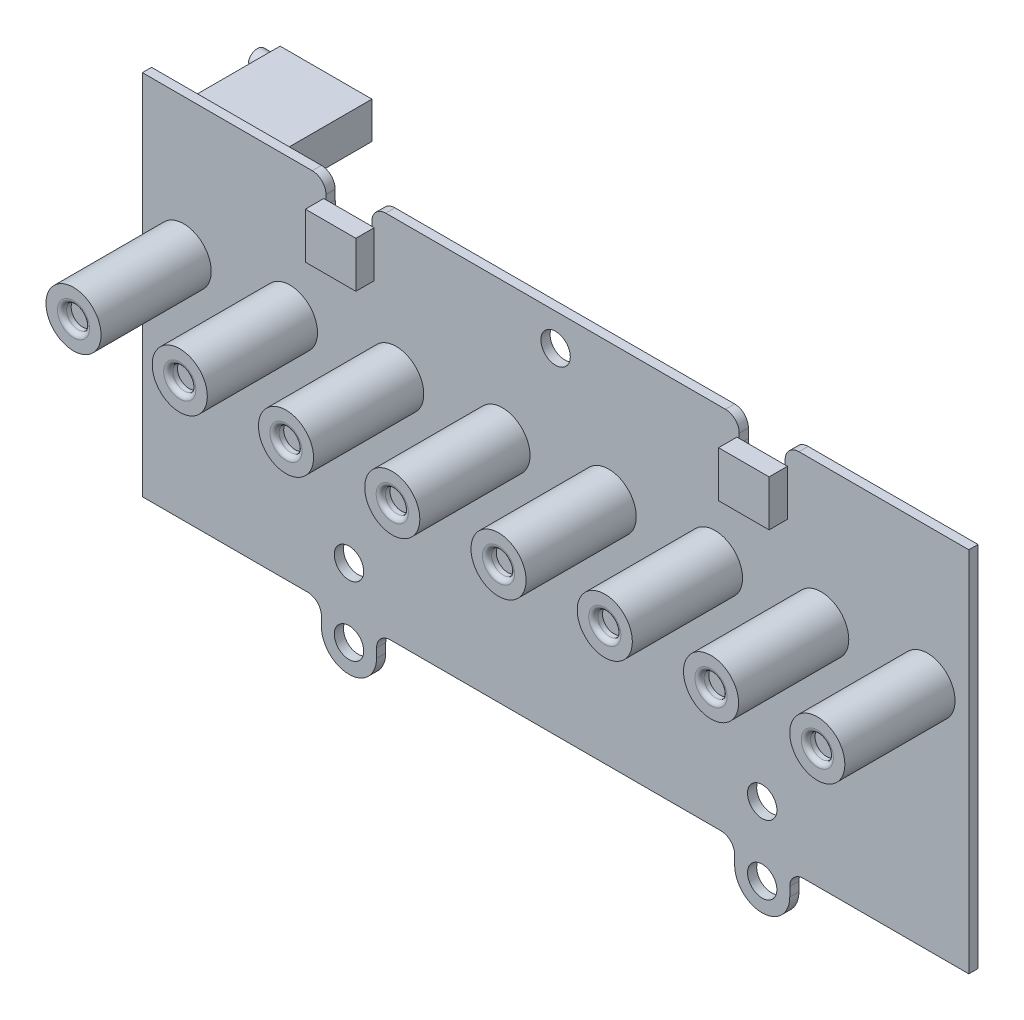
from build123d import *

# Parameters (mm, degrees)
SKETCH_1_R          = 1.6
EXTRUDE_1_DEPTH     = 1
FILLET_2_R          = 1.5
SKETCH_2_W          = 5.5
SKETCH_2_H          = 5
EXTRUDE_7_DEPTH     = 2
SKETCH_3_R          = 3
EXTRUDE_8_DEPTH     = 12
SKETCH_4_R          = 1.25
CUT_EXTRUDE_1_DEPTH = 1
FILLET_3_R          = 0.5
SKETCH_5_W          = 10
SKETCH_5_H          = 4
EXTRUDE_9_DEPTH     = 10
SKETCH_6_R          = 1
EXTRUDE_10_DEPTH    = 1.2
CUT_EXTRUDE_START   = -0.1
CUT_EXTRUDE_2_DEPTH = 0.1
SKETCH_8_W          = 10
SKETCH_8_H          = 4
SKETCH_8_W_2        = 6
EXTRUDE_11_DEPTH    = 2
EXTRUDE_12_DEPTH    = 3
SKETCH_11_R         = 0.25
EXTRUDE_13_DEPTH    = 7


with BuildPart() as part:
    # 草图1 → 凸台-拉伸1 (new body)
    with BuildSketch(Plane.XY):
        with BuildLine():
            Line((45, -20), (25.5, -20))
            Line((25.5, -20), (25.5, -22.5))
            ThreePointArc((25.5, -22.5), (22.5, -25.5), (19.5, -22.5))
            Line((19.5, -22.5), (19.5, -20))
            Line((19.5, -20), (-19.5, -20))
            Line((-19.5, -20), (-19.5, -22.5))
            ThreePointArc((-19.5, -22.5), (-22.5, -25.5), (-25.5, -22.5))
            Line((-25.5, -22.5), (-25.5, -20))
            Line((-25.5, -20), (-45, -20))
            Line((-45, -20), (-45, 20))
            Line((-45, 20), (-25, 20))
            Line((-25, 20), (-25, 17.5))
            ThreePointArc((-25, 17.5), (-22.5, 15), (-20, 17.5))
            Line((-20, 17.5), (-20, 20))
            Line((-20, 20), (20, 20))
            Line((20, 20), (20, 17.5))
            ThreePointArc((20, 17.5), (22.5, 15), (25, 17.5))
            Line((25, 17.5), (25, 20))
            Line((25, 20), (45, 20))
            Line((45, 20), (45, -20))
        make_face()
        with Locations((0, 16.5)):
            Circle(SKETCH_1_R, mode=Mode.SUBTRACT)
        with Locations((-22.5, -15)):
            Circle(SKETCH_1_R, mode=Mode.SUBTRACT)
        with Locations((22.5, -15)):
            Circle(SKETCH_1_R, mode=Mode.SUBTRACT)
        with Locations((-22.5, -22.5)):
            Circle(SKETCH_1_R, mode=Mode.SUBTRACT)
        with Locations(Location((22.5, -22.5, 0), (0, 0, 180))):
            Circle(SKETCH_1_R, mode=Mode.SUBTRACT)
    extrude(amount=EXTRUDE_1_DEPTH)

    # 圆角2
    fillet_2_edges = [part.edges().sort_by_distance(p)[0] for p in [
        (-25, 20, 0.5),
        (-20, 20, 0.5),
        (20, 20, 0.5),
        (25, 20, 0.5),
        (25.5, -20, 0.5),
        (19.5, -20, 0.5),
        (-19.5, -20, 0.5),
        (-25.5, -20, 0.5),
    ]]
    fillet(fillet_2_edges, radius=FILLET_2_R)

    # 草图2 → 凸台-拉伸7 (add)
    with BuildSketch(Plane.XY.offset(1)):
        with Locations((-22.5, 15.5)):
            Rectangle(SKETCH_2_W, SKETCH_2_H)
    extrude_7 = extrude(amount=EXTRUDE_7_DEPTH)

    # 镜向1: 凸台-拉伸7 across plane
    add(extrude_7.mirror(Plane(origin=(0, 0, 0), x_dir=(0, 0, 1), z_dir=(1, 0, 0))))

    # 草图3 → 凸台-拉伸8 (add)
    with BuildSketch(Plane.XY.offset(1)):
        with Locations((-40.5, 5)):
            Circle(SKETCH_3_R)
        with Locations((-28.928571429, 5)):
            Circle(SKETCH_3_R)
        with Locations((-17.357142857, 5)):
            Circle(SKETCH_3_R)
        with Locations((-5.785714286, 5)):
            Circle(SKETCH_3_R)
        with Locations((5.785714286, 5)):
            Circle(SKETCH_3_R)
        with Locations((17.357142857, 5)):
            Circle(SKETCH_3_R)
        with Locations((28.928571429, 5)):
            Circle(SKETCH_3_R)
        with Locations((40.5, 5)):
            Circle(SKETCH_3_R)
    extrude(amount=EXTRUDE_8_DEPTH)

    # 草图4 → 切除-拉伸1 (cut)
    with BuildSketch(Plane.XY.offset(13)):
        with Locations((-40.5, 5)):
            Circle(SKETCH_4_R)
        with Locations((-28.928571429, 5)):
            Circle(SKETCH_4_R)
        with Locations((-17.357142857, 5)):
            Circle(SKETCH_4_R)
        with Locations((-5.785714286, 5)):
            Circle(SKETCH_4_R)
        with Locations((5.785714286, 5)):
            Circle(SKETCH_4_R)
        with Locations((17.357142857, 5)):
            Circle(SKETCH_4_R)
        with Locations((28.928571429, 5)):
            Circle(SKETCH_4_R)
        with Locations((40.5, 5)):
            Circle(SKETCH_4_R)
    extrude(amount=-CUT_EXTRUDE_1_DEPTH, mode=Mode.SUBTRACT)

    # 圆角3
    fillet_3_edges = [part.edges().sort_by_distance(p)[0] for p in [
        (-41.75, 5, 13),
        (-30.178571429, 5, 13),
        (-18.607142857, 5, 13),
        (-7.035714286, 5, 13),
        (4.535714286, 5, 13),
        (16.107142857, 5, 13),
        (27.678571429, 5, 13),
        (39.25, 5, 13),
    ]]
    fillet(fillet_3_edges, radius=FILLET_3_R)

    # 草图5 → 凸台-拉伸9 (add)
    with BuildSketch(Plane(origin=(0, 0, 0), x_dir=(-1, 0, 0), z_dir=(0, 0, -1))):
        with Locations((36, 17)):
            Rectangle(SKETCH_5_W, SKETCH_5_H)
    extrude(amount=EXTRUDE_9_DEPTH)

    # 草图6 → 凸台-拉伸10 (add)
    with BuildSketch(Plane.ZY.offset(41)):
        with Locations(Location((-8.726067531, 17.810214326, 0), (0, 0, 180))):
            Circle(SKETCH_6_R)
    extrude(amount=EXTRUDE_10_DEPTH)

    # 草图7 → 切除-拉伸2 (cut)
    with BuildSketch(Plane.ZY.offset(42.2).offset(CUT_EXTRUDE_START)):
        with BuildLine():
            Line((-7.730069562, 17.899590194), (-9.677413706, 18.118338417))
            ThreePointArc((-9.677413706, 18.118338417), (-9.719817428, 17.921843811), (-9.7220655, 17.720838458))
            Line((-9.7220655, 17.720838458), (-7.774721356, 17.502090236))
            ThreePointArc((-7.774721356, 17.502090236), (-7.738305876, 17.654243456), (-7.726067531, 17.810214326))
            ThreePointArc((-7.726067531, 17.810214326), (-7.72706854, 17.854947038), (-7.730069562, 17.899590194))
        make_face()
    extrude(amount=CUT_EXTRUDE_2_DEPTH, mode=Mode.SUBTRACT)

    # 草图8 → 凸台-拉伸11 (add)
    with BuildSketch(Plane(origin=(0, 0, 0), x_dir=(-1, 0, 0), z_dir=(0, 0, -1))):
        with Locations((-11, -6)):
            Rectangle(SKETCH_8_W, SKETCH_8_H)
        with Locations((2, -6)):
            Rectangle(SKETCH_8_W_2, SKETCH_8_H)
        with Locations((17, -6)):
            Rectangle(SKETCH_8_W, SKETCH_8_H)
    extrude(amount=EXTRUDE_11_DEPTH)

    # 草图10 → 凸台-拉伸12 (add)
    with BuildSketch(Plane(origin=(0, 0, 0), x_dir=(-1, 0, 0), z_dir=(0, 0, -1))):
        Polygon((-30, -4.625), (-30, -7.375), (-29.375, -8), (-28.125, -8), (-27.5, -7.375), (-26.875, -8), (-25.625, -8), (-25, -7.375), (-24.375, -8), (-23.125, -8), (-22.5, -7.375), (-21.875, -8), (-20.625, -8), (-20, -7.375), (-20, -4.625), (-20.625, -4), (-21.875, -4), (-22.5, -4.625), (-23.125, -4), (-24.375, -4), (-25, -4.625), (-25.625, -4), (-26.875, -4), (-27.5, -4.625), (-28.125, -4), (-29.375, -4), align=None)
        Polygon((30, -4.625), (30, -7.375), (30.625, -8), (31.875, -8), (32.5, -7.375), (33.125, -8), (34.375, -8), (35, -7.375), (35.625, -8), (36.875, -8), (37.5, -7.375), (38.125, -8), (39.375, -8), (40, -7.375), (40, -4.625), (39.375, -4), (38.125, -4), (37.5, -4.625), (36.875, -4), (35.625, -4), (35, -4.625), (34.375, -4), (33.125, -4), (32.5, -4.625), (31.875, -4), (30.625, -4), align=None)
    extrude(amount=EXTRUDE_12_DEPTH)

    # 草图11 → 凸台-拉伸13 (add)
    with BuildSketch(Plane(origin=(0, 0, -3), x_dir=(-1, 0, 0), z_dir=(0, 0, -1))):
        with Locations(Location((-28.75, -5.25, 0), (0, 0, 180))):
            Circle(SKETCH_11_R)
        with Locations(Location((-26.25, -5.25, 0), (0, 0, 180))):
            Circle(SKETCH_11_R)
        with Locations(Location((-23.75, -5.25, 0), (0, 0, 180))):
            Circle(SKETCH_11_R)
        with Locations(Location((-21.25, -5.25, 0), (0, 0, 180))):
            Circle(SKETCH_11_R)
        with Locations(Location((-21.25, -6.75, 0), (0, 0, 180))):
            Circle(SKETCH_11_R)
        with Locations(Location((-23.75, -6.75, 0), (0, 0, 180))):
            Circle(SKETCH_11_R)
        with Locations(Location((-26.25, -6.75, 0), (0, 0, 180))):
            Circle(SKETCH_11_R)
        with Locations(Location((-28.75, -6.75, 0), (0, 0, 180))):
            Circle(SKETCH_11_R)
        with Locations(Location((31.25, -5.25, 0), (0, 0, 180))):
            Circle(SKETCH_11_R)
        with Locations(Location((33.75, -5.25, 0), (0, 0, 180))):
            Circle(SKETCH_11_R)
        with Locations(Location((36.25, -5.25, 0), (0, 0, 180))):
            Circle(SKETCH_11_R)
        with Locations(Location((38.75, -5.25, 0), (0, 0, 180))):
            Circle(SKETCH_11_R)
        with Locations(Location((38.75, -6.75, 0), (0, 0, 180))):
            Circle(SKETCH_11_R)
        with Locations(Location((36.25, -6.75, 0), (0, 0, 180))):
            Circle(SKETCH_11_R)
        with Locations(Location((33.75, -6.75, 0), (0, 0, 180))):
            Circle(SKETCH_11_R)
        with Locations(Location((31.25, -6.75, 0), (0, 0, 180))):
            Circle(SKETCH_11_R)
    extrude(amount=EXTRUDE_13_DEPTH)


solid = part.part
